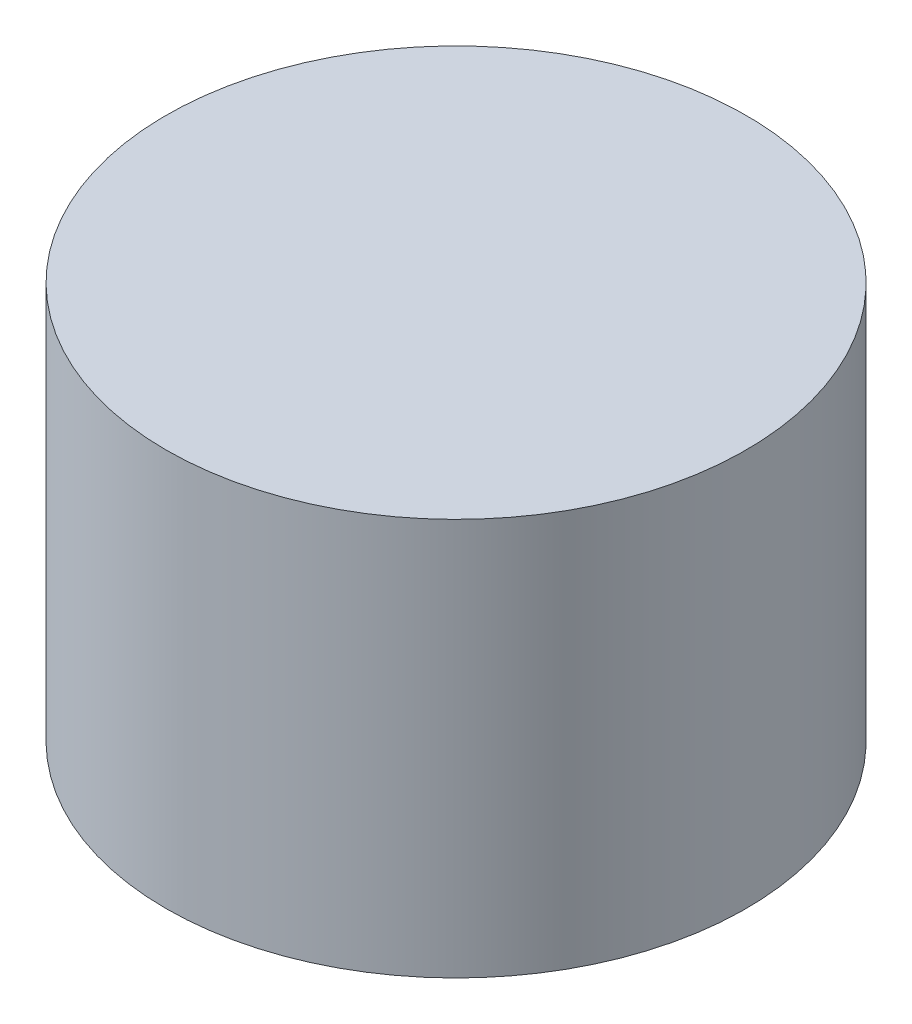
from build123d import *

# Parameters (mm, degrees)
SKETCH1_R           = 0.365
BOSS_EXTRUDE1_DEPTH = 0.5


with BuildPart() as part:
    # Sketch1 → Boss-Extrude1 (new body)
    with BuildSketch(Plane(origin=(0, 0, 0), x_dir=(1, 0, 0), z_dir=(0, 1, 0))):
        with Locations(Location((0, 0, 0), (0, 0, 270))):
            Circle(SKETCH1_R)
    extrude(amount=BOSS_EXTRUDE1_DEPTH)


solid = part.part
